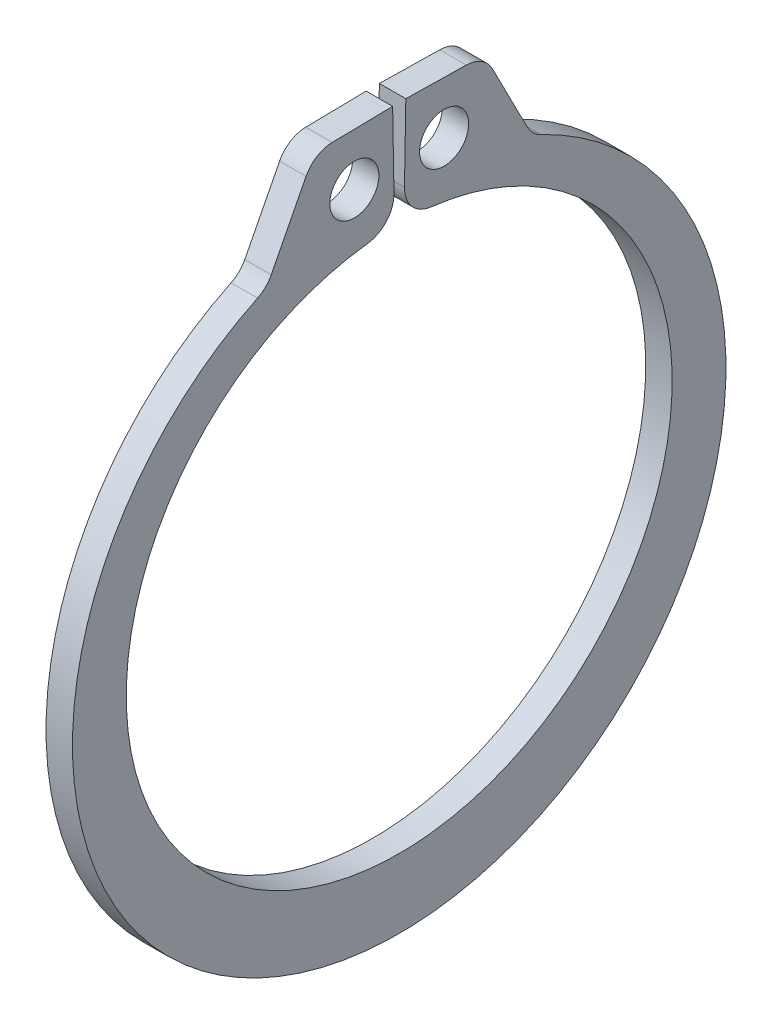
from build123d import *

# Parameters (mm, degrees)
BOSS_EXTRUDE1_DEPTH      = 0.5334
BOSS_EXTRUDE1_DEPTH_BACK = 0.5334
SKETCH3_R                = 0.9906
FILLET1_R                = 1.2065


with BuildPart() as part:
    # Sketch3 → Boss-Extrude1 (new, two sides: drawn at the far end of the back side and taken through both)
    with BuildSketch(Plane(origin=(0, 0, 0), x_dir=(0, 0, -1), z_dir=(1, 0, 0)).offset(-BOSS_EXTRUDE1_DEPTH_BACK)):
        with BuildLine():
            Line((-3.427571395, 15.169791064), (-5.352943643, 11.418661811))
            ThreePointArc((-5.352943643, 11.418661811), (0, -13.8049), (5.352943643, 11.418661811))
            Line((5.352943643, 11.418661811), (3.427571395, 15.169791064))
            Line((3.427571395, 15.169791064), (0.265753029, 15.224980808))
            Line((0.265753029, 15.224980808), (0.192166702, 11.009222987))
            ThreePointArc((0.192166702, 11.009222987), (0, -11.0109), (-0.192166702, 11.009222987))
            Line((-0.192166702, 11.009222987), (-0.265753029, 15.224980808))
            Line((-0.265753029, 15.224980808), (-3.427571395, 15.169791064))
        make_face()
        with Locations((-1.809869048, 13.089507025)):
            Circle(SKETCH3_R, mode=Mode.SUBTRACT)
        with Locations((1.809869048, 13.089507025)):
            Circle(SKETCH3_R, mode=Mode.SUBTRACT)
    extrude(amount=BOSS_EXTRUDE1_DEPTH + BOSS_EXTRUDE1_DEPTH_BACK)

    # Fillet1
    fillet1_edges = [part.edges().sort_by_distance(p)[0] for p in [
        (0, 11.418661811, 5.352943643),
        (0, 15.169791064, 3.427571395),
        (0, 11.009222987, 0.192166702),
        (0, 11.009222987, -0.192166702),
        (0, 15.169791064, -3.427571395),
        (0, 11.418661811, -5.352943643),
    ]]
    fillet(fillet1_edges, radius=FILLET1_R)


solid = part.part
